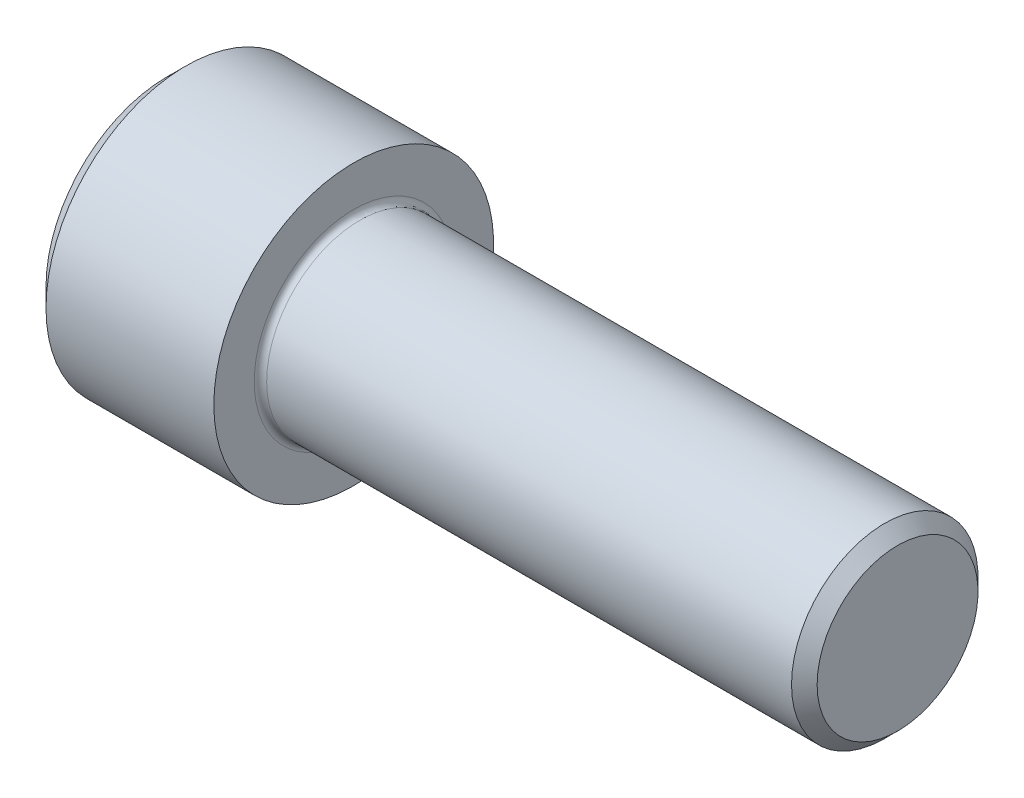
from build123d import *

# Parameters (mm, degrees)
FILLET1_R    = 0.8
HEX_2_DEPTH  = 12
SCALE1_SCALE = 0.1


with BuildPart() as part:
    # BodySke → Base-Revolve (revolve)
    with BuildSketch(Plane.XY, mode=Mode.PRIVATE) as base_revolve_sk:
        Polygon((0, 0), (0, 15.6), (2.4, 18), (24, 18), (24, 12), (92.352, 12), (94, 10.352), (94, 0), align=None)
    revolve(base_revolve_sk.sketch.rotate(Axis((-31.75, 0, 0), (1, 0, 0)), 90), axis=Axis((-31.75, 0, 0), (1, 0, 0)))

    # Fillet1
    fillet1_edges = [part.edges().sort_by_distance(p)[0] for p in [
        (24, 0, -12),
    ]]
    fillet(fillet1_edges, radius=FILLET1_R)

    # Sketch2 → Hex-PreBroach (revolve, cut)
    with BuildSketch(Plane.XY, mode=Mode.PRIVATE) as hex_prebroach_sk:
        Polygon((0, 9.6375), (12, 9.6375), (17.564213219, 0), (0, 0), align=None)
    revolve(hex_prebroach_sk.sketch.rotate(Axis((0, 0, 0), (1, 0, 0)), 90), axis=Axis((0, 0, 0), (1, 0, 0)), mode=Mode.SUBTRACT)

    # Sketch3 → Hex 2 (cut)
    with BuildSketch(Plane(origin=(0, 0, 0), x_dir=(0, 0.500000000000001, 0.866025403784438), z_dir=(-1, 0, 0))):
        Polygon((5.564213219, 9.6375), (-5.564213219, 9.6375), (-11.128426439, 0), (-5.564213219, -9.6375), (5.564213219, -9.6375), (11.128426439, 0), align=None)
    extrude(amount=-HEX_2_DEPTH, mode=Mode.SUBTRACT)


with BuildPart() as part_1:
    # Scale1: scaled about (41.367569692, 0, 0)
    add(part.part.scale(SCALE1_SCALE).moved(Location((37.230812723, 0, 0))))


solid = part_1.part
